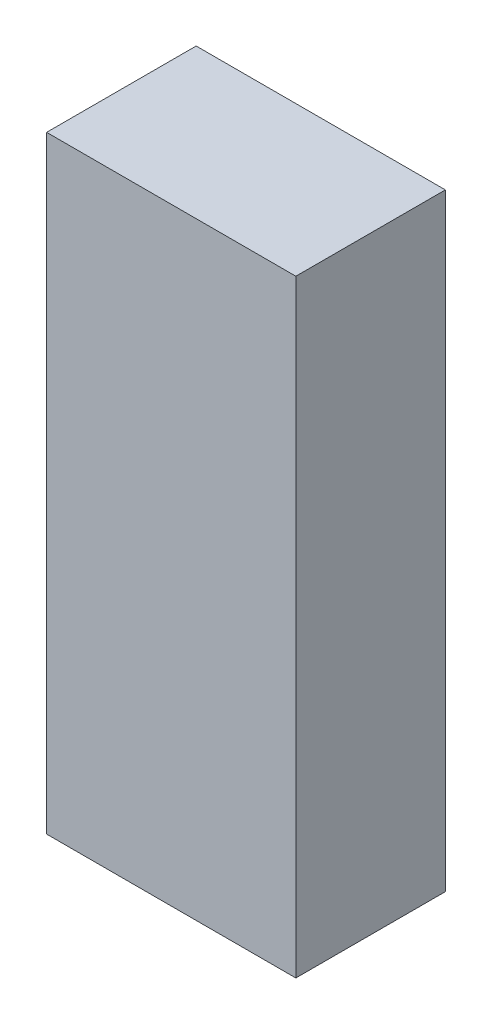
from build123d import *

# Parameters (mm, degrees)
SKETCH1_W      = 15.5
SKETCH1_H      = 37.8
ENVELOPE_DEPTH = 9.3


with BuildPart() as part:
    # Sketch1 → Envelope (new body)
    with BuildSketch(Plane.XY):
        Rectangle(SKETCH1_W, SKETCH1_H)
    extrude(amount=ENVELOPE_DEPTH)


solid = part.part
